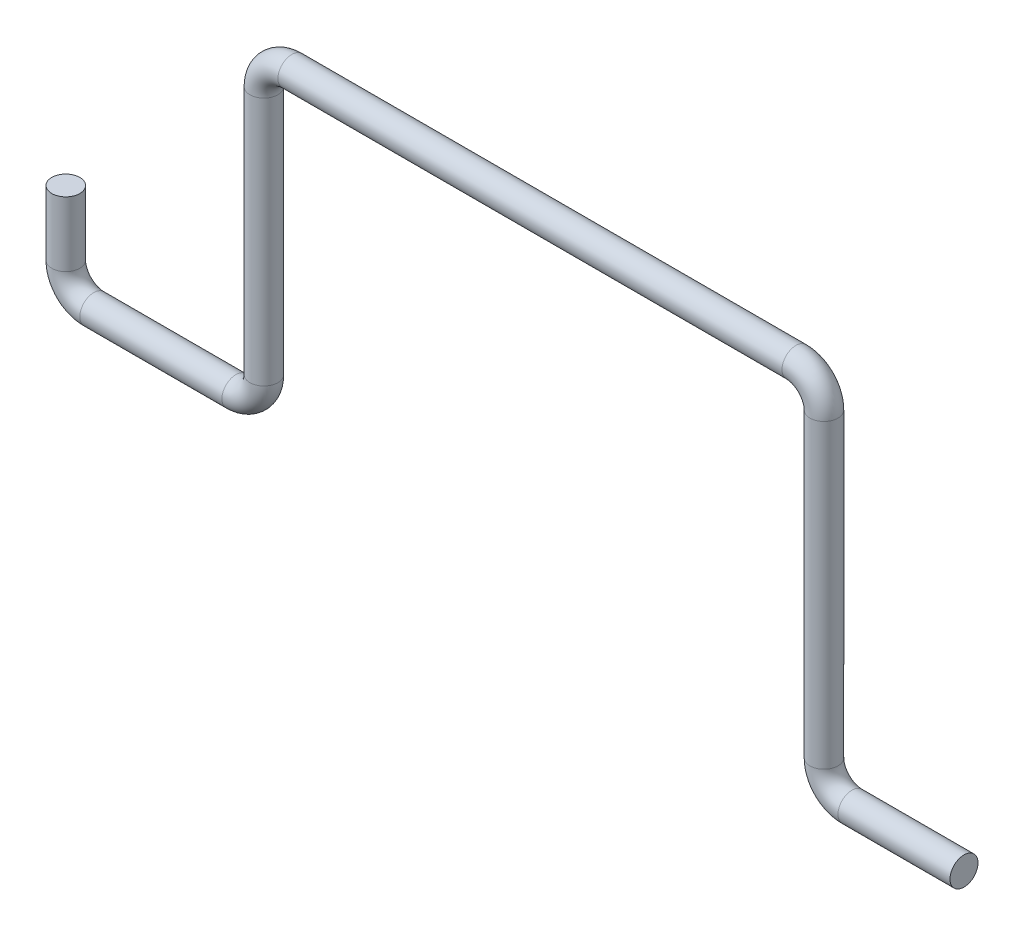
from build123d import *

# Parameters (mm, degrees)
SKETCH2_R = 0.1


with BuildPart() as part:
    # Sweep1: sweep along a curve in space
    with BuildLine() as sweep1_path:
        Line((0, 0, 0), (-0.8, 0, 0))
        ThreePointArc((-0.8, 0, 0), (-0.941421356, 0.058578644, 0), (-1, 0.2, 0))
        Line((-1, 0.2, 0), (-1, 2.35103818, 0))
        ThreePointArc((-1, 2.35103818, 0), (-1.058578644, 2.492459536, 0), (-1.2, 2.55103818, 0))
        Line((-1.2, 2.55103818, 0), (-4.8, 2.55103818, 0))
        ThreePointArc((-4.8, 2.55103818, 0), (-4.941421356, 2.492459536, 0), (-5, 2.35103818, 0))
        Line((-5, 2.35103818, 0), (-5, 0.570308291, 0))
        ThreePointArc((-5, 0.570308291, 0), (-5.058578644, 0.428886934, 0), (-5.2, 0.370308291, 0))
        Line((-5.2, 0.370308291, 0), (-6.215003673, 0.370308291, 0))
        ThreePointArc((-6.215003673, 0.370308291, 0), (-6.356425029, 0.428886934, 0), (-6.415003673, 0.570308291, 0))
        Line((-6.415003673, 0.570308291, 0), (-6.415003673, 1.032684647, 0))
    # Sketch2 → Sweep1 (sweep)
    with BuildSketch(Plane(origin=(0, 0, 0), x_dir=(0, 0, -1), z_dir=(1, 0, 0))):
        Circle(SKETCH2_R)
    sweep(path=sweep1_path.line)


solid = part.part
